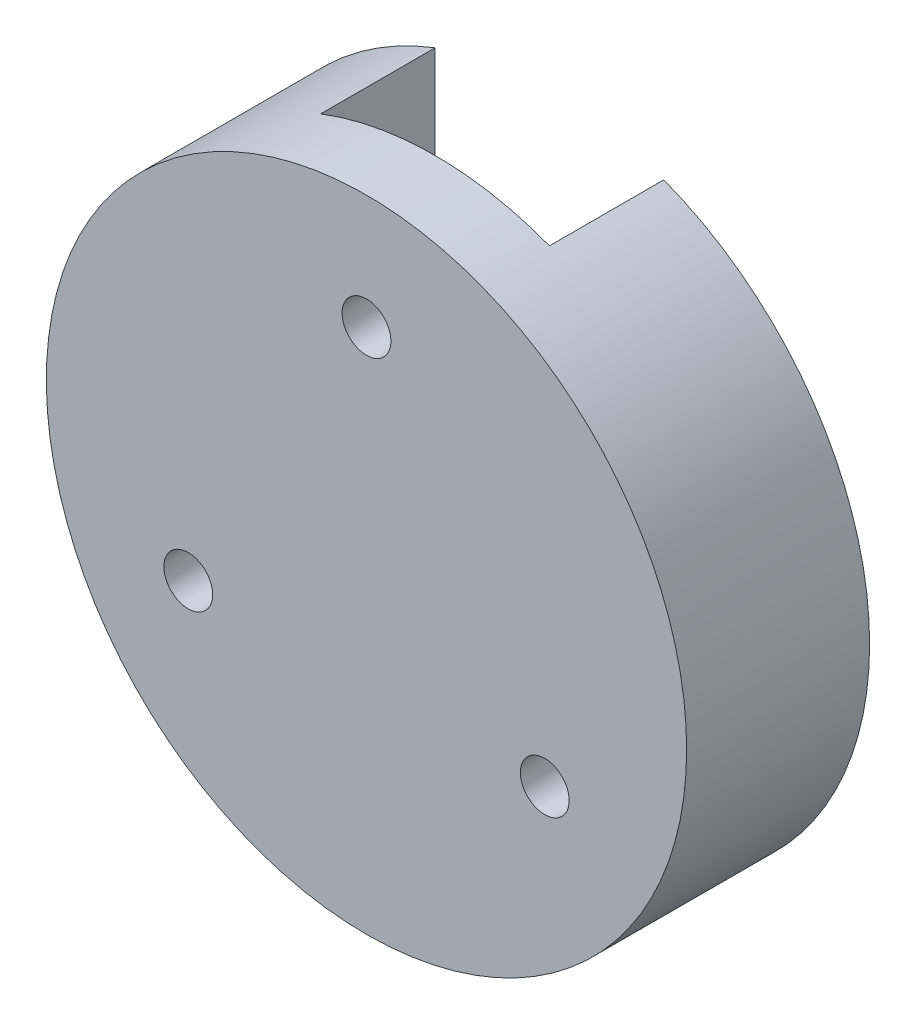
from build123d import *

# Parameters (mm, degrees)
SKETCH_1_R          = 21
EXTRUDE_1_DEPTH     = 3
EXTRUDE_START       = 9
SKETCH_2_R          = 21
EXTRUDE_2_DEPTH     = 9
SKETCH_3_R          = 1.6
CUT_EXTRUDE_1_DEPTH = 26.5
SKETCH_6_W          = 15
SKETCH_6_H          = 50
CUT_EXTRUDE_3_DEPTH = 7.5


with BuildPart() as part:
    # 草图1 → 凸台-拉伸1 (new body)
    with BuildSketch(Plane.XY):
        Circle(SKETCH_1_R)
    extrude(amount=EXTRUDE_1_DEPTH)

    # 草图2 → 凸台-拉伸2 (add)
    with BuildSketch(Plane(origin=(0, 0, 0), x_dir=(-1, 0, 0), z_dir=(0, 0, -1)).offset(EXTRUDE_START)):
        Circle(SKETCH_2_R)
    extrude(amount=-EXTRUDE_2_DEPTH)

    # 草图3 → 切除-拉伸1 (cut)
    with BuildSketch(Plane(origin=(0, 0, -9), x_dir=(-1, 0, 0), z_dir=(0, 0, -1))):
        with Locations((0, 13.5)):
            Circle(SKETCH_3_R)
        with Locations((11.691342951, -6.75)):
            Circle(SKETCH_3_R)
        with Locations((-11.691342951, -6.75)):
            Circle(SKETCH_3_R)
    extrude(amount=-CUT_EXTRUDE_1_DEPTH, mode=Mode.SUBTRACT)

    # 草图6 → 切除-拉伸3 (cut)
    with BuildSketch(Plane(origin=(0, 0, -9), x_dir=(-1, 0, 0), z_dir=(0, 0, -1))):
        Rectangle(SKETCH_6_W, SKETCH_6_H)
    extrude(amount=-CUT_EXTRUDE_3_DEPTH, mode=Mode.SUBTRACT)


solid = part.part
